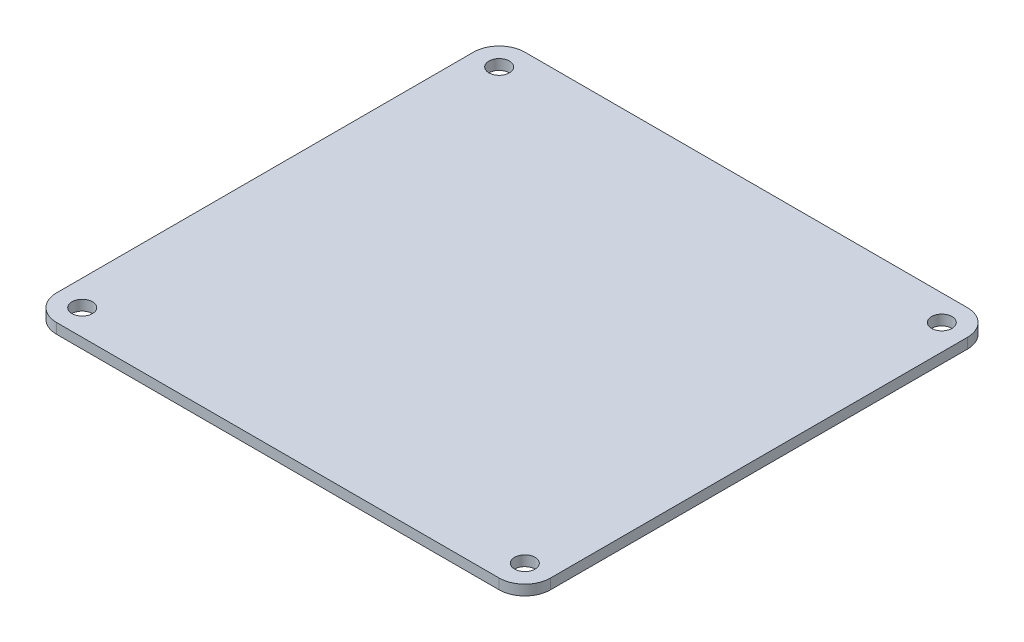
from build123d import *

# Parameters (mm, degrees)
SKETCH1_W           = 77
SKETCH1_H           = 73
BOSS_EXTRUDE1_DEPTH = 1.6
FILLET1_R           = 4
SKETCH3_R           = 1.6
CUT_EXTRUDE1_DEPTH  = 1.6


with BuildPart() as part:
    # Sketch1 → Boss-Extrude1 (new body)
    with BuildSketch(Plane(origin=(0, 0, 0), x_dir=(1, 0, 0), z_dir=(0, 1, 0))):
        with Locations((38.5, 36.5)):
            Rectangle(SKETCH1_W, SKETCH1_H)
    extrude(amount=BOSS_EXTRUDE1_DEPTH)

    # Fillet1
    fillet1_edges = [part.edges().sort_by_distance(p)[0] for p in [
        (0, 0.8, -73),
        (77, 0.8, -73),
        (77, 0.8, 0),
        (0, 0.8, 0),
    ]]
    fillet(fillet1_edges, radius=FILLET1_R)

    # Sketch3 → Cut-Extrude1 (cut)
    with BuildSketch(Plane(origin=(0, 1.6, 0), x_dir=(1, 0, 0), z_dir=(0, 1, 0))):
        with Locations(Location((4, 69, 0), (0, 0, 270))):
            Circle(SKETCH3_R)
        with Locations(Location((73, 69, 0), (0, 0, 270))):
            Circle(SKETCH3_R)
        with Locations(Location((73, 4, 0), (0, 0, 270))):
            Circle(SKETCH3_R)
        with Locations(Location((4, 4, 0), (0, 0, 270))):
            Circle(SKETCH3_R)
    extrude(amount=-CUT_EXTRUDE1_DEPTH, mode=Mode.SUBTRACT)


solid = part.part
